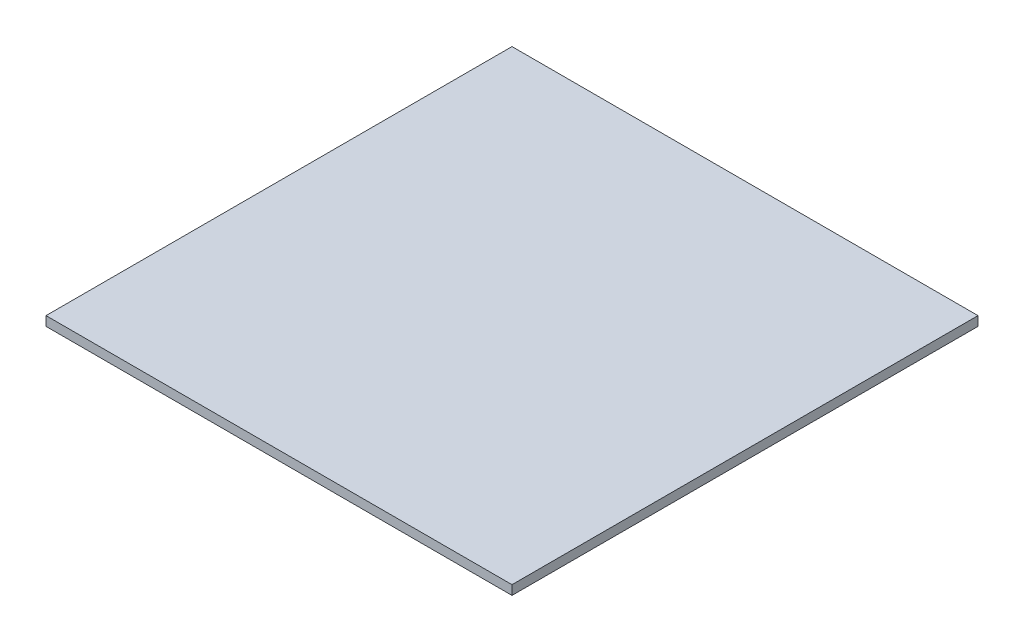
from build123d import *

# Parameters (mm, degrees)
SKETCH1_W      = 475.399989
SKETCH1_H      = 9.525
EXTRUDE1_DEPTH = 237.6999945


with BuildPart() as part:
    # Sketch1 → Extrude1 (new, symmetric)
    with BuildSketch(Plane.XY):
        with Locations((0, -4.7625)):
            Rectangle(SKETCH1_W, SKETCH1_H)
    extrude(amount=EXTRUDE1_DEPTH, both=True)


solid = part.part
